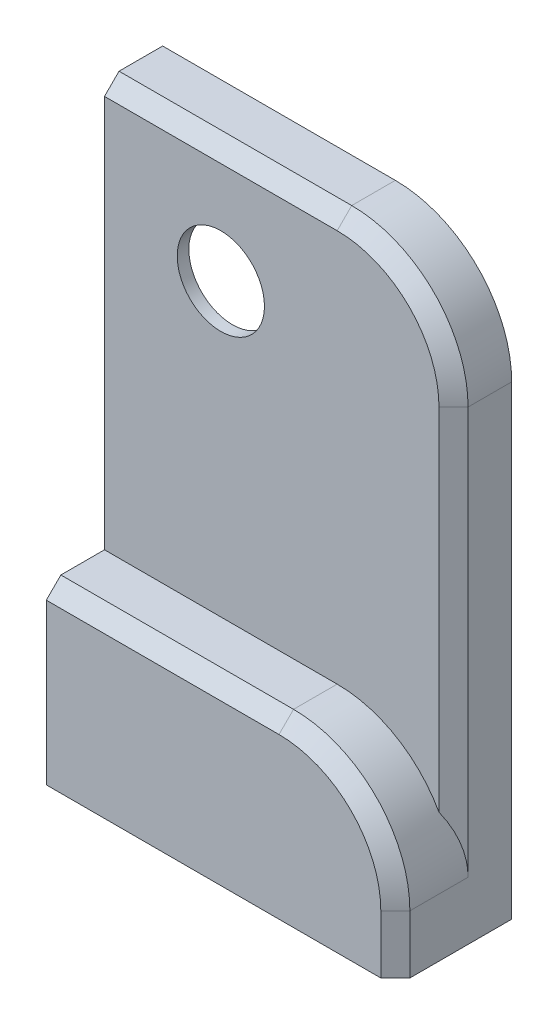
from build123d import *

# Parameters (mm, degrees)
SKETCH1_W           = 76.2
SKETCH1_H           = 127
BOSS_EXTRUDE1_DEPTH = 12.7
SKETCH2_W           = 76.2
SKETCH2_H           = 38.1
BOSS_EXTRUDE2_DEPTH = 12.7
SKETCH3_R           = 9.525
CUT_EXTRUDE1_DEPTH  = 149.649688866
FILLET1_R           = 25.4
CHAMFER1_SIZE       = 3.175
SHELL1_T            = -2.54


with BuildPart() as part:
    # Sketch1 → Boss-Extrude1 (new body)
    with BuildSketch(Plane.XY):
        with Locations((-38.1, -63.5)):
            Rectangle(SKETCH1_W, SKETCH1_H)
    extrude(amount=BOSS_EXTRUDE1_DEPTH)

    # Sketch2 → Boss-Extrude2 (add)
    with BuildSketch(Plane.XY.offset(12.7)):
        with Locations((-38.1, -107.95)):
            Rectangle(SKETCH2_W, SKETCH2_H)
    extrude(amount=BOSS_EXTRUDE2_DEPTH)

    # Sketch3 → Cut-Extrude1 (cut, through all)
    with BuildSketch(Plane.XY.offset(12.7)):
        with Locations((-50.8, -25.4)):
            Circle(SKETCH3_R)
    extrude(amount=-CUT_EXTRUDE1_DEPTH, mode=Mode.SUBTRACT)

    # Fillet1
    fillet1_edges = [part.edges().sort_by_distance(p)[0] for p in [
        (0, -88.9, 19.05),
        (0, 0, 6.35),
    ]]
    fillet(fillet1_edges, radius=FILLET1_R)

    # Chamfer1
    chamfer1_edges = [part.edges().sort_by_distance(p)[0] for p in [
        (0, -69.85, 12.7),
        (0, -120.65, 25.4),
        (-50.8, -88.9, 25.4),
        (-7.439487758, -96.339487758, 25.4),
        (-50.8, 0, 12.7),
        (-7.439487758, -7.439487758, 12.7),
    ]]
    chamfer(chamfer1_edges, length=CHAMFER1_SIZE)

    # Shell1
    shell1_openings = [part.faces().sort_by_distance(p)[0] for p in [
        (-60.325, -25.4, 6.35),
        (-38.193985292, -65.538658625, 0),
        (-38.196714534, -127, 12.669604003),
        (-76.2, -73.894162641, 9.238687601),
    ]]
    offset(amount=SHELL1_T, openings=shell1_openings, kind=Kind.INTERSECTION)


solid = part.part
